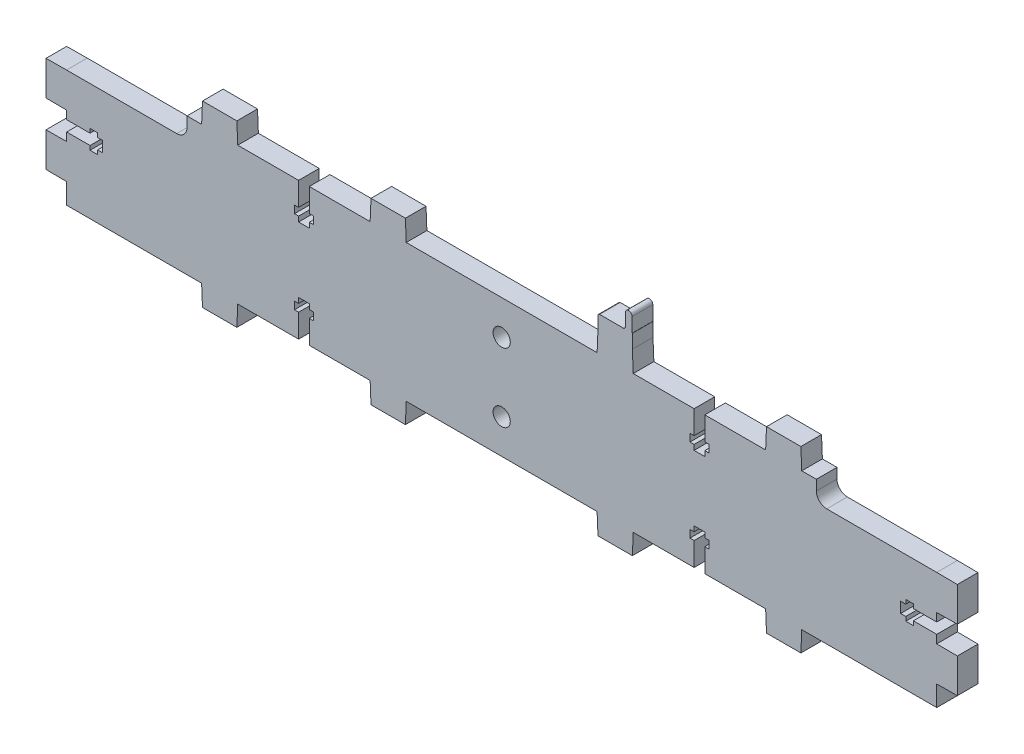
from build123d import *

# Parameters (mm, degrees)
SKETCH_1_R      = 2.5
EXTRUDE_1_DEPTH = 6


with BuildPart() as part:
    # Эскиз1 → Бобышка-Вытянуть1 (new body)
    with BuildSketch(Plane.XY):
        with BuildLine():
            Line((-28, -30.6), (-27.75, -24.6))
            Line((-27.75, -24.6), (27.75, -24.6))
            Line((27.75, -24.6), (28, -30.6))
            Line((28, -30.6), (38, -30.6))
            Line((38, -30.6), (38.25, -24.6))
            Line((38.25, -24.6), (55.95, -24.6))
            Line((55.95, -24.6), (55.95, -17.8))
            Line((55.95, -17.8), (54.75, -17.8))
            Line((54.75, -17.8), (54.75, -15.6))
            Line((54.75, -15.6), (55.95, -15.6))
            Line((55.95, -15.6), (55.95, -14.1))
            Line((55.95, -14.1), (59.05, -14.1))
            Line((59.05, -14.1), (59.05, -15.6))
            Line((59.05, -15.6), (60.25, -15.6))
            Line((60.25, -15.6), (60.25, -17.8))
            Line((60.25, -17.8), (59.05, -17.8))
            Line((59.05, -17.8), (59.05, -24.6))
            Line((59.05, -24.6), (71.55, -24.6))
            Line((71.55, -24.6), (76.75, -24.6))
            Line((76.75, -24.6), (77, -30.6))
            Line((77, -30.6), (87, -30.6))
            Line((87, -30.6), (87.25, -24.6))
            Line((87.25, -24.6), (126.5, -24.6))
            Line((126.5, -24.6), (126.5, -18.65))
            Line((126.5, -18.65), (132.5, -18.6))
            Line((132.5, -18.6), (132.5, -8.6))
            Line((132.5, -8.6), (126.5, -8.55))
            Line((126.5, -8.55), (126.5, -6.15))
            Line((126.5, -6.15), (119.7, -6.15))
            Line((119.7, -6.15), (119.7, -7.35))
            Line((119.7, -7.35), (117.5, -7.35))
            Line((117.5, -7.35), (117.5, -6.15))
            Line((117.5, -6.15), (116, -6.15))
            Line((116, -6.15), (116, -3.05))
            Line((116, -3.05), (117.5, -3.05))
            Line((117.5, -3.05), (117.5, -1.85))
            Line((117.5, -1.85), (119.7, -1.85))
            Line((119.7, -1.85), (119.7, -3.05))
            Line((119.7, -3.05), (126.5, -3.05))
            Line((126.5, -3.05), (126.5, -0.65))
            Line((126.5, -0.65), (132.5, -0.6))
            Line((132.5, -0.6), (132.5, 9.4))
            Line((132.5, 9.4), (126.5, 9.45))
            Line((126.5, 9.45), (94.5, 9.45))
            ThreePointArc((94.5, 9.45), (92.378679656, 10.328679656), (91.5, 12.45))
            Line((91.5, 12.45), (91.5, 15.4))
            Line((91.5, 15.4), (87.25, 15.4))
            Line((87.25, 15.4), (87, 21.4))
            Line((87, 21.4), (77, 21.4))
            Line((77, 21.4), (76.75, 15.4))
            Line((76.75, 15.4), (59.05, 15.4))
            Line((59.05, 15.4), (59.05, 8.6))
            Line((59.05, 8.6), (60.25, 8.6))
            Line((60.25, 8.6), (60.25, 6.4))
            Line((60.25, 6.4), (59.05, 6.4))
            Line((59.05, 6.4), (59.05, 4.9))
            Line((59.05, 4.9), (55.95, 4.9))
            Line((55.95, 4.9), (55.95, 6.4))
            Line((55.95, 6.4), (54.75, 6.4))
            Line((54.75, 6.4), (54.75, 8.6))
            Line((54.75, 8.6), (55.95, 8.6))
            Line((55.95, 8.6), (55.95, 15.4))
            Line((55.95, 15.4), (38.25, 15.4))
            Line((38.25, 15.4), (38, 21.4))
            Line((38, 21.4), (38, 25.4))
            Line((38, 25.4), (37.942164229, 25.4))
            Line((37.942164229, 25.4), (37.942164229, 29.6))
            ThreePointArc((37.942164229, 29.6), (36.942164229, 30.6), (35.942164229, 29.6))
            Line((35.942164229, 29.6), (35.942164229, 26))
            ThreePointArc((35.942164229, 26), (35.766428298, 25.575735931), (35.342164229, 25.4))
            Line((35.342164229, 25.4), (28.5, 25.4))
            ThreePointArc((28.5, 25.4), (28.146446609, 25.253553391), (28, 24.9))
            Line((28, 24.9), (28, 21.4))
            Line((28, 21.4), (27.75, 15.4))
            Line((27.75, 15.4), (-27.75, 15.4))
            Line((-27.75, 15.4), (-28, 21.4))
            Line((-28, 21.4), (-38, 21.4))
            Line((-38, 21.4), (-38.25, 15.4))
            Line((-38.25, 15.4), (-43.45, 15.4))
            Line((-43.45, 15.4), (-55.95, 15.4))
            Line((-55.95, 15.4), (-55.95, 8.6))
            Line((-55.95, 8.6), (-54.75, 8.6))
            Line((-54.75, 8.6), (-54.75, 6.4))
            Line((-54.75, 6.4), (-55.95, 6.4))
            Line((-55.95, 6.4), (-55.95, 4.9))
            Line((-55.95, 4.9), (-59.05, 4.9))
            Line((-59.05, 4.9), (-59.05, 6.4))
            Line((-59.05, 6.4), (-60.25, 6.4))
            Line((-60.25, 6.4), (-60.25, 8.6))
            Line((-60.25, 8.6), (-59.05, 8.6))
            Line((-59.05, 8.6), (-59.05, 15.4))
            Line((-59.05, 15.4), (-64.25, 15.4))
            Line((-64.25, 15.4), (-76.75, 15.4))
            Line((-76.75, 15.4), (-77, 21.4))
            Line((-77, 21.4), (-87, 21.4))
            Line((-87, 21.4), (-87.25, 15.4))
            Line((-87.25, 15.4), (-91.5, 15.4))
            Line((-91.5, 15.4), (-91.5, 12.45))
            ThreePointArc((-91.5, 12.45), (-92.378679656, 10.328679656), (-94.5, 9.45))
            Line((-94.5, 9.45), (-126.5, 9.45))
            Line((-126.5, 9.45), (-132.5, 9.4))
            Line((-132.5, 9.4), (-132.5, -0.6))
            Line((-132.5, -0.6), (-126.5, -0.65))
            Line((-126.5, -0.65), (-126.5, -3.05))
            Line((-126.5, -3.05), (-119.7, -3.05))
            Line((-119.7, -3.05), (-119.7, -1.85))
            Line((-119.7, -1.85), (-117.5, -1.85))
            Line((-117.5, -1.85), (-117.5, -3.05))
            Line((-117.5, -3.05), (-116, -3.05))
            Line((-116, -3.05), (-116, -6.15))
            Line((-116, -6.15), (-117.5, -6.15))
            Line((-117.5, -6.15), (-117.5, -7.35))
            Line((-117.5, -7.35), (-119.7, -7.35))
            Line((-119.7, -7.35), (-119.7, -6.15))
            Line((-119.7, -6.15), (-126.5, -6.15))
            Line((-126.5, -6.15), (-126.5, -8.55))
            Line((-126.5, -8.55), (-132.5, -8.6))
            Line((-132.5, -8.6), (-132.5, -18.6))
            Line((-132.5, -18.6), (-126.5, -18.65))
            Line((-126.5, -18.65), (-126.5, -24.6))
            Line((-126.5, -24.6), (-87.25, -24.6))
            Line((-87.25, -24.6), (-87, -30.6))
            Line((-87, -30.6), (-77, -30.6))
            Line((-77, -30.6), (-76.75, -24.6))
            Line((-76.75, -24.6), (-64.25, -24.6))
            Line((-64.25, -24.6), (-59.05, -24.6))
            Line((-59.05, -24.6), (-59.05, -17.8))
            Line((-59.05, -17.8), (-60.25, -17.8))
            Line((-60.25, -17.8), (-60.25, -15.6))
            Line((-60.25, -15.6), (-59.05, -15.6))
            Line((-59.05, -15.6), (-59.05, -14.1))
            Line((-59.05, -14.1), (-55.95, -14.1))
            Line((-55.95, -14.1), (-55.95, -15.6))
            Line((-55.95, -15.6), (-54.75, -15.6))
            Line((-54.75, -15.6), (-54.75, -17.8))
            Line((-54.75, -17.8), (-55.95, -17.8))
            Line((-55.95, -17.8), (-55.95, -24.6))
            Line((-55.95, -24.6), (-43.45, -24.6))
            Line((-43.45, -24.6), (-38.25, -24.6))
            Line((-38.25, -24.6), (-38, -30.6))
            Line((-38, -30.6), (-28, -30.6))
        make_face()
        with Locations((0, -14.6)):
            Circle(SKETCH_1_R, mode=Mode.SUBTRACT)
        with Locations((0, 5.4)):
            Circle(SKETCH_1_R, mode=Mode.SUBTRACT)
    extrude(amount=EXTRUDE_1_DEPTH)


solid = part.part
